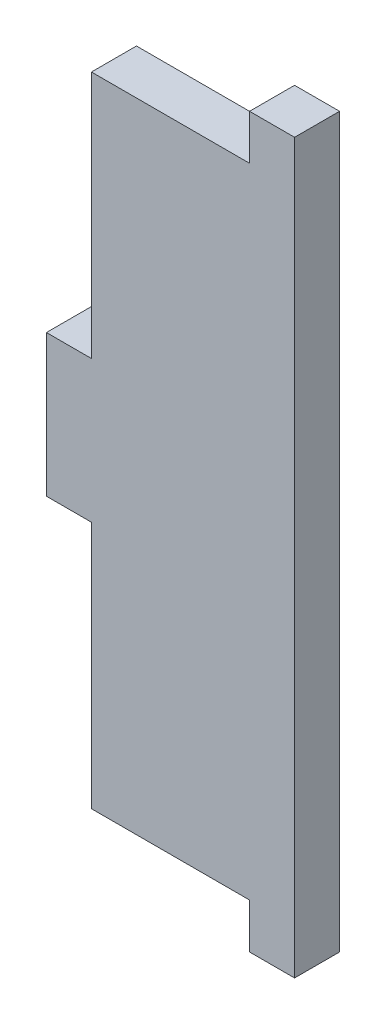
from build123d import *

# Parameters (mm, degrees)
BOSS_EXTRUDE1_DEPTH = 6.35


with BuildPart() as part:
    # Sketch1 → Boss-Extrude1 (new body)
    with BuildSketch(Plane.XY):
        Polygon((0, 0), (0, -35), (-6.35, -35), (-6.35, -55), (0, -55), (0, -90), (22.3, -90), (22.3, -96.35), (28.65, -96.35), (28.65, -90), (28.65, -6.35), (28.65, 6.35), (22.3, 6.35), (22.3, 0), align=None)
    extrude(amount=BOSS_EXTRUDE1_DEPTH)


solid = part.part
